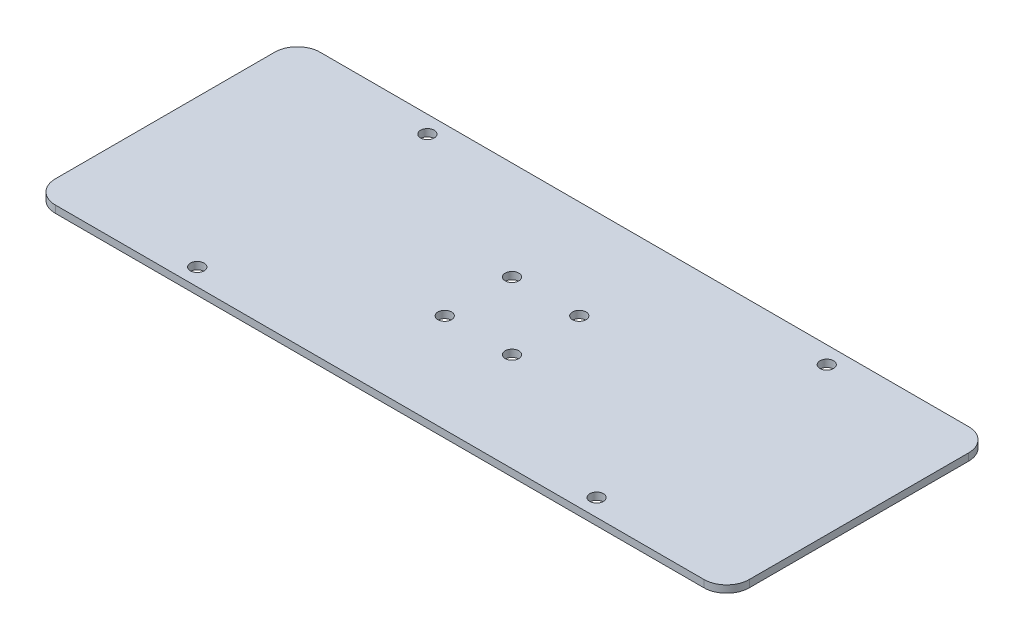
from build123d import *

# Parameters (mm, degrees)
SKETCH_1_R      = 1.5
EXTRUDE_1_DEPTH = 1.6


with BuildPart() as part:
    # 草图1 → 凸台-拉伸1 (new body)
    with BuildSketch(Plane(origin=(0, 0, 0), x_dir=(1, 0, 0), z_dir=(0, 1, 0))):
        with BuildLine():
            Line((-68.066067042, 38.496019103), (75.093932958, 38.496019103))
            ThreePointArc((75.093932958, 38.496019103), (78.629466864, 37.031553009), (80.093932958, 33.496019103))
            Line((80.093932958, 33.496019103), (80.093932958, -14.923980897))
            ThreePointArc((80.093932958, -14.923980897), (78.629466864, -18.459514803), (75.093932958, -19.923980897))
            Line((75.093932958, -19.923980897), (-68.066067042, -19.923980897))
            ThreePointArc((-68.066067042, -19.923980897), (-71.601600948, -18.459514803), (-73.066067042, -14.923980897))
            Line((-73.066067042, -14.923980897), (-73.066067042, 33.496019103))
            ThreePointArc((-73.066067042, 33.496019103), (-71.601600948, 37.031553009), (-68.066067042, 38.496019103))
        make_face()
        with Locations(Location((-40.556067042, 34.686019103, 0), (0, 0, 270))):
            Circle(SKETCH_1_R, mode=Mode.SUBTRACT)
        with Locations(Location((-40.556067042, -16.113980897, 0), (0, 0, 270))):
            Circle(SKETCH_1_R, mode=Mode.SUBTRACT)
        with Locations(Location((47.583932958, 34.686019103, 0), (0, 0, 270))):
            Circle(SKETCH_1_R, mode=Mode.SUBTRACT)
        with Locations(Location((47.583932958, -16.113980897, 0), (0, 0, 270))):
            Circle(SKETCH_1_R, mode=Mode.SUBTRACT)
        with Locations(Location((-3.910309428, 16.711019103, 0), (0, 0, 270))):
            Circle(SKETCH_1_R, mode=Mode.SUBTRACT)
        with Locations(Location((10.938175421, 1.86101918, 0), (0, 0, 270))):
            Circle(SKETCH_1_R, mode=Mode.SUBTRACT)
        with Locations(Location((10.939690572, 16.711019103, 0), (0, 0, 270))):
            Circle(SKETCH_1_R, mode=Mode.SUBTRACT)
        with Locations(Location((-3.91182427, 1.864049483, 0), (0, 0, 270))):
            Circle(SKETCH_1_R, mode=Mode.SUBTRACT)
    extrude(amount=EXTRUDE_1_DEPTH)


solid = part.part
